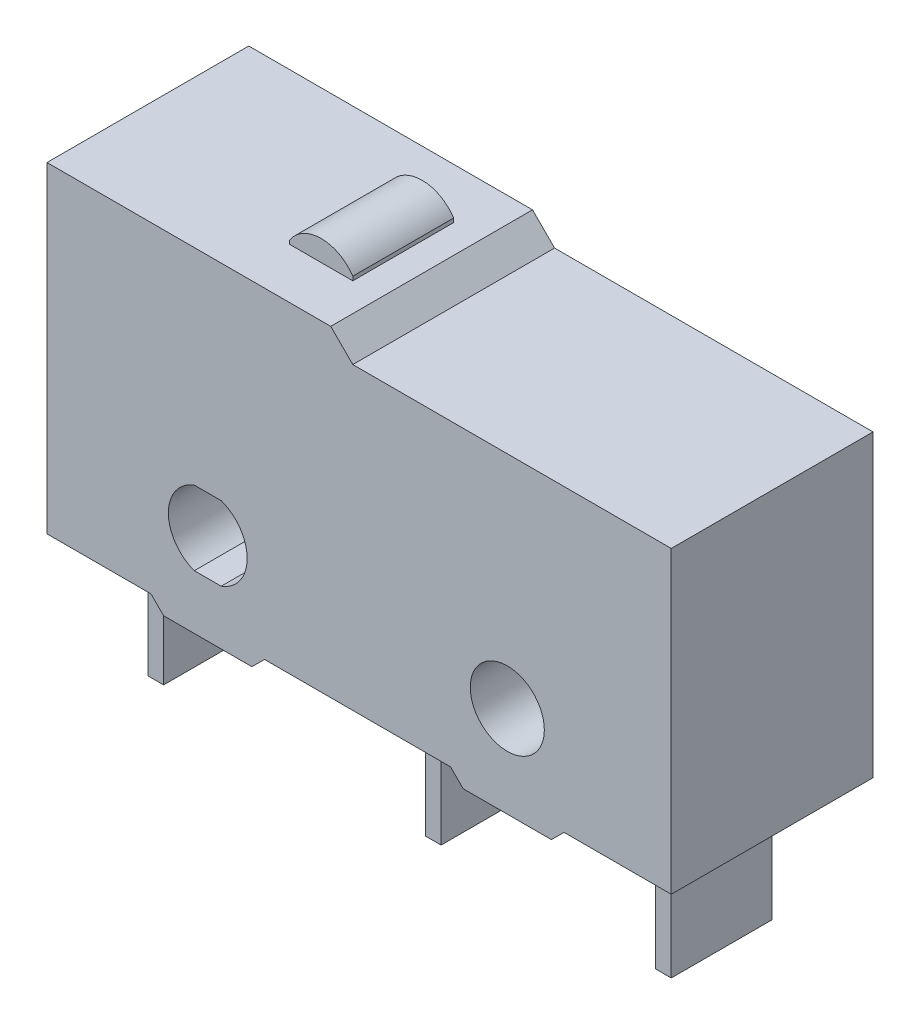
from build123d import *

# Parameters (mm, degrees)
SKETCH1_W                    = 19.8
SKETCH1_H                    = 10.6
BOSS_EXTRUDE1_DEPTH          = 6.4
SKETCH2_W                    = 10.8
SKETCH2_H                    = 0.7
CUT_EXTRUDE1_DEPTH           = 18.703389506
SKETCH3_W                    = 3.3
SKETCH3_H                    = 0.4
CUT_EXTRUDE2_DEPTH           = 18.703389506
SKETCH4_W                    = 5.9
SKETCH4_H                    = 0.4
CUT_EXTRUDE3_DEPTH           = 18.703389506
SKETCH5_W                    = 3.4
SKETCH5_H                    = 0.4
CUT_EXTRUDE4_DEPTH           = 18.703389506
CUT_EXTRUDE5_DEPTH           = 18.703389506
BOSS_EXTRUDE2_DEPTH          = 3.2
SKETCH8_W                    = 0.5
SKETCH8_H                    = 3.2
BOSS_EXTRUDE3_DEPTH          = 3.9
SKETCH9_W                    = 0.5
SKETCH9_H                    = 3.2
BOSS_EXTRUDE4_DEPTH          = 3.9
SKETCH10_W                   = 0.5
SKETCH10_H                   = 3.2
BOSS_EXTRUDE5_DEPTH          = 3.9
DRAFT1_ANGLE                 = 45
DRAFT2_ANGLE                 = 45
DRAFT3_ANGLE                 = 45
DRAFT4_ANGLE                 = 45
F_2_35_2_35_DIAMETER_HOLE1_D = 2.35


with BuildPart() as part:
    # Sketch1 → Boss-Extrude1 (new body)
    with BuildSketch(Plane.XY.offset(3.2)):
        with Locations((-4.7, 2.4)):
            Rectangle(SKETCH1_W, SKETCH1_H)
    extrude(amount=-BOSS_EXTRUDE1_DEPTH)

    # Sketch2 → Cut-Extrude1 (cut, through all)
    with BuildSketch(Plane(origin=(0, 0, -3.2), x_dir=(-1, 0, 0), z_dir=(0, 0, -1))):
        with Locations((0.2, 7.35)):
            Rectangle(SKETCH2_W, SKETCH2_H)
    extrude(amount=-CUT_EXTRUDE1_DEPTH, mode=Mode.SUBTRACT)

    # Sketch3 → Cut-Extrude2 (cut, through all)
    with BuildSketch(Plane(origin=(0, 0, -3.2), x_dir=(-1, 0, 0), z_dir=(0, 0, -1))):
        with Locations((12.95, -2.7)):
            Rectangle(SKETCH3_W, SKETCH3_H)
    extrude(amount=-CUT_EXTRUDE2_DEPTH, mode=Mode.SUBTRACT)

    # Sketch4 → Cut-Extrude3 (cut, through all)
    with BuildSketch(Plane(origin=(0, 0, -3.2), x_dir=(-1, 0, 0), z_dir=(0, 0, -1))):
        with Locations((4.75, -2.7)):
            Rectangle(SKETCH4_W, SKETCH4_H)
    extrude(amount=-CUT_EXTRUDE3_DEPTH, mode=Mode.SUBTRACT)

    # Sketch5 → Cut-Extrude4 (cut, through all)
    with BuildSketch(Plane(origin=(0, 0, -3.2), x_dir=(-1, 0, 0), z_dir=(0, 0, -1))):
        with Locations((-3.5, -2.7)):
            Rectangle(SKETCH5_W, SKETCH5_H)
    extrude(amount=-CUT_EXTRUDE4_DEPTH, mode=Mode.SUBTRACT)

    # Sketch6 → Cut-Extrude5 (cut, through all)
    with BuildSketch(Plane(origin=(0, 0, -3.2), x_dir=(-1, 0, 0), z_dir=(0, 0, -1))):
        with BuildLine():
            Line((9.073531947, -1.175), (9.926468053, -1.175))
            ThreePointArc((9.926468053, -1.175), (10.75, 0), (9.926468053, 1.175))
            Line((9.926468053, 1.175), (9.073531947, 1.175))
            ThreePointArc((9.073531947, 1.175), (8.25, 0), (9.073531947, -1.175))
        make_face()
    extrude(amount=-CUT_EXTRUDE5_DEPTH, mode=Mode.SUBTRACT)

    # Sketch7 → Boss-Extrude2 (add)
    with BuildSketch(Plane.XY.offset(1.6)):
        with BuildLine():
            Line((-8.5, 7.825612234), (-8.5, 7.7))
            Line((-8.5, 7.7), (-6.5, 7.7))
            Line((-6.5, 7.7), (-6.5, 7.825612234))
            ThreePointArc((-6.5, 7.825612234), (-7.5, 8.362287276), (-8.5, 7.825612234))
        make_face()
    extrude(amount=-BOSS_EXTRUDE2_DEPTH)

    # Sketch8 → Boss-Extrude3 (add)
    with BuildSketch(Plane.XZ.offset(2.5)):
        with Locations((-3.95, 0)):
            Rectangle(SKETCH8_W, SKETCH8_H)
    extrude(amount=BOSS_EXTRUDE3_DEPTH)

    # Sketch9 → Boss-Extrude4 (add)
    with BuildSketch(Plane.XZ.offset(2.5)):
        with Locations((3.35, 0)):
            Rectangle(SKETCH9_W, SKETCH9_H)
    extrude(amount=BOSS_EXTRUDE4_DEPTH)

    # Sketch10 → Boss-Extrude5 (add)
    with BuildSketch(Plane.XZ.offset(2.5)):
        with Locations((-12.75, 0)):
            Rectangle(SKETCH10_W, SKETCH10_H)
    extrude(amount=BOSS_EXTRUDE5_DEPTH)

    # Draft1
    draft1_faces = [part.faces().sort_by_distance(p)[0] for p in [
        (-5.6, 7.35, 0),
    ]]
    draft(draft1_faces, Plane(origin=(5.2, 7.7, -3.2), x_dir=(1, 0, 0), z_dir=(0, 1, 0)), DRAFT1_ANGLE)

    # Draft2
    draft2_faces = [part.faces().sort_by_distance(p)[0] for p in [
        (1.8, -2.7, 0),
    ]]
    draft(draft2_faces, Plane(origin=(1.8, -2.5, 3.2), x_dir=(0, 0, -1), z_dir=(0, -1, 0)), DRAFT2_ANGLE)

    # Draft3
    draft3_faces = [part.faces().sort_by_distance(p)[0] for p in [
        (-11.3, -2.7, 0),
    ]]
    draft(draft3_faces, Plane(origin=(-14.6, -2.5, 3.2), x_dir=(0, 0, -1), z_dir=(0, -1, 0)), DRAFT3_ANGLE)

    # Draft4
    draft4_faces = [part.faces().sort_by_distance(p)[0] for p in [
        (-7.7, -2.7, 0),
        (-1.8, -2.7, 0),
    ]]
    draft(draft4_faces, Plane(origin=(-7.7, -2.5, 3.2), x_dir=(0, 0, -1), z_dir=(0, -1, 0)), DRAFT4_ANGLE)

    # Ø2.35 (2.35) Diameter Hole1 (through all)
    with Locations(Plane.XY.offset(3.2)):
        with Locations((0, 0)):
            Hole(F_2_35_2_35_DIAMETER_HOLE1_D / 2)


solid = part.part
